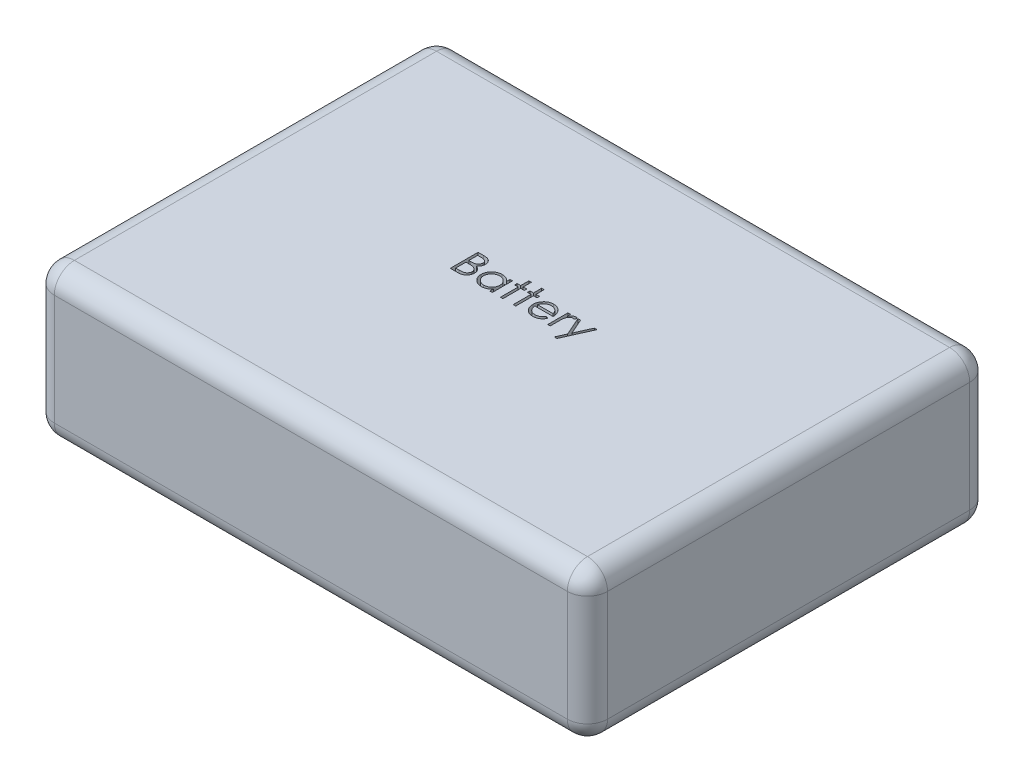
from build123d import *

# Parameters (mm, degrees)
SKETCH1_W           = 69.85
SKETCH1_H           = 50.8
BOSS_EXTRUDE1_DEPTH = 19.05
CUT_EXTRUDE1_DEPTH  = 2.54
FILLET1_R           = 2.54


with BuildPart() as part:
    # Sketch1 → Boss-Extrude1 (new body)
    with BuildSketch(Plane(origin=(0, 0, 0), x_dir=(1, 0, 0), z_dir=(0, 1, 0))):
        Rectangle(SKETCH1_W, SKETCH1_H)
    extrude(amount=BOSS_EXTRUDE1_DEPTH)

    # Sketch2 → Cut-Extrude1 (cut)
    # profile 1 of 7: a face of its own
    with BuildSketch(Plane(origin=(0, 19.05, 0), x_dir=(1, 0, 0), z_dir=(0, 1, 0))):
        with BuildLine():
            Line((-7.78525641, 3.5), (-7.102363782, 3.5))
            add(Edge.make_bspline(
                [(-7.102363782, 3.5), (-7.068935304, 3.49982425), (-7.004142594, 3.499483602), (-6.909923152, 3.49420047), (-6.821674341, 3.486996801), (-6.739370569, 3.475566708), (-6.663049866, 3.461774931), (-6.592482229, 3.445073115), (-6.527892057, 3.425046501), (-6.45077932, 3.39320022), (-6.36285866, 3.345877051), (-6.267660267, 3.275948486), (-6.186256027, 3.190416023), (-6.11606971, 3.093933368), (-6.060268591, 2.987797596), (-6.019899293, 2.874538407), (-5.994341418, 2.755616665), (-5.991712984, 2.673973487), (-5.990384615, 2.63271234)],
                knots=[0, 0, 0, 0, 1.001505555, 1.941167018, 2.826882275, 3.653841531, 4.429895133, 5.150066043, 5.825578002, 6.45369114, 7.647487171, 8.808567382, 9.977351308, 11.170798116, 12.373658725, 13.556498008, 14.765093433, 16, 16, 16, 16], degree=3))
            add(Edge.make_bspline(
                [(-5.990384615, 2.63271234), (-5.991477834, 2.594059784), (-5.993626111, 2.518103867), (-6.01416887, 2.407009758), (-6.046329539, 2.301258539), (-6.091034788, 2.201236154), (-6.149136784, 2.10920254), (-6.217995103, 2.024415274), (-6.301071905, 1.950464217), (-6.363315145, 1.909121315), (-6.394931891, 1.888120994)],
                knots=[0, 0, 0, 0, 1.044552857, 2.05264487, 3.044412934, 4.028983338, 5.005914585, 5.980388656, 6.974128949, 8, 8, 8, 8], degree=3))
            add(Edge.make_bspline(
                [(-6.394931891, 1.888120994), (-6.355171463, 1.872855995), (-6.279099916, 1.84365027), (-6.174413904, 1.792014806), (-6.084219059, 1.735852696), (-6.007821913, 1.674520846), (-5.942484258, 1.608412035), (-5.885431316, 1.536556921), (-5.836749942, 1.458018163), (-5.795037018, 1.373614627), (-5.762488262, 1.284208159), (-5.738112358, 1.190637383), (-5.724144909, 1.093237828), (-5.722157268, 1.026952448), (-5.721153846, 0.993489583)],
                knots=[0, 0, 0, 0, 1.27268992, 2.434971085, 3.483601985, 4.442670788, 5.356604649, 6.2567628, 7.179492994, 8.113709626, 9.066344395, 10.018646069, 10.999752585, 12, 12, 12, 12], degree=3))
            add(Edge.make_bspline(
                [(-5.721153846, 0.993489583), (-5.722130692, 0.959322711), (-5.724052664, 0.892098433), (-5.738232636, 0.793343299), (-5.762241743, 0.698968352), (-5.795312889, 0.608363169), (-5.838475204, 0.521703035), (-5.891003168, 0.438889771), (-5.953634732, 0.36075544), (-6.023697601, 0.286431817), (-6.102959746, 0.21960403), (-6.188475501, 0.160088323), (-6.281321821, 0.111142261), (-6.379973815, 0.070026239), (-6.485538131, 0.038619041), (-6.597540739, 0.016646467), (-6.71588504, 0.00184143), (-6.797094791, 0.000624225), (-6.838741987, 0)],
                knots=[0, 0, 0, 0, 0.978564426, 1.925352924, 2.850884081, 3.763762016, 4.682927383, 5.618979971, 6.567305752, 7.547517671, 8.540179244, 9.531824382, 10.526200242, 11.540722885, 12.589160233, 13.674978461, 14.80764778, 16, 16, 16, 16], degree=3))
            Line((-6.838741987, 0), (-7.78525641, 0))
            Line((-7.78525641, 0), (-7.78525641, 3.5))
        make_face()
        with BuildLine():
            Line((-7.471153846, 3.141025641), (-7.471153846, 2.019230769))
            Line((-7.471153846, 2.019230769), (-7.260116186, 2.019230769))
            add(Edge.make_bspline(
                [(-7.260116186, 2.019230769), (-7.229267391, 2.019630692), (-7.169661231, 2.020403425), (-7.083341335, 2.022616942), (-7.003216317, 2.028814985), (-6.929424483, 2.035011248), (-6.862082039, 2.045085835), (-6.801338178, 2.057077958), (-6.746239581, 2.069760863), (-6.682700036, 2.09133035), (-6.610627087, 2.123208025), (-6.533793983, 2.172679861), (-6.466059513, 2.231604215), (-6.408862326, 2.299595176), (-6.362050855, 2.374461362), (-6.32953714, 2.455008243), (-6.307489856, 2.539228375), (-6.305498324, 2.597046627), (-6.304487179, 2.626402244)],
                knots=[0, 0, 0, 0, 1.156816544, 2.235205308, 3.236616184, 4.169592532, 5.011045266, 5.787822928, 6.49130361, 7.128639758, 8.301311294, 9.436451833, 10.541879658, 11.654887649, 12.756523258, 13.837046038, 14.901820046, 16, 16, 16, 16], degree=3))
            add(Edge.make_bspline(
                [(-6.304487179, 2.626402244), (-6.30501336, 2.645828015), (-6.30604552, 2.683933787), (-6.314498822, 2.739483141), (-6.328866397, 2.791726894), (-6.34732069, 2.841381004), (-6.373109379, 2.886892854), (-6.403472842, 2.92983605), (-6.440158532, 2.968748169), (-6.481915845, 3.005117667), (-6.529924468, 3.037362195), (-6.584155759, 3.065602958), (-6.645343437, 3.088343735), (-6.712456292, 3.108259887), (-6.786527379, 3.122248181), (-6.866701932, 3.133901569), (-6.953636651, 3.139834311), (-7.013781754, 3.140619673), (-7.044871795, 3.141025641)],
                knots=[0, 0, 0, 0, 0.91205012, 1.789085906, 2.630437955, 3.453916878, 4.269457761, 5.079663411, 5.91843418, 6.774407191, 7.675494373, 8.627863946, 9.638891023, 10.736472738, 11.911756761, 13.175263542, 14.539845004, 16, 16, 16, 16], degree=3))
            Line((-7.044871795, 3.141025641), (-7.471153846, 3.141025641))
        make_face(mode=Mode.SUBTRACT)
        with BuildLine():
            Line((-7.471153846, 1.66025641), (-7.471153846, 0.358974359))
            Line((-7.471153846, 0.358974359), (-7.023838141, 0.358974359))
            add(Edge.make_bspline(
                [(-7.023838141, 0.358974359), (-6.991819215, 0.359358106), (-6.930106957, 0.360097729), (-6.841005726, 0.362512283), (-6.758422623, 0.368004559), (-6.682734487, 0.376650409), (-6.613124034, 0.386028858), (-6.550426331, 0.398640139), (-6.494133138, 0.413089099), (-6.42885883, 0.435423272), (-6.355355322, 0.470119743), (-6.276144465, 0.522433969), (-6.205718247, 0.584757277), (-6.145912988, 0.656888191), (-6.096899999, 0.735319518), (-6.061244544, 0.818464868), (-6.039253688, 0.904950395), (-6.036591518, 0.963917108), (-6.03525641, 0.993489583)],
                knots=[0, 0, 0, 0, 1.160039823, 2.235823828, 3.228722157, 4.157150951, 4.99529583, 5.772374946, 6.472645482, 7.099169577, 8.269452708, 9.405989375, 10.527446681, 11.663510218, 12.788923519, 13.866172445, 14.929861265, 16, 16, 16, 16], degree=3))
            add(Edge.make_bspline(
                [(-6.03525641, 0.993489583), (-6.035532515, 1.011982924), (-6.03608027, 1.048671306), (-6.044340885, 1.102587125), (-6.056354754, 1.154812998), (-6.071886188, 1.205490739), (-6.094505655, 1.253704115), (-6.1209122, 1.300406674), (-6.151873602, 1.345660154), (-6.200117768, 1.402872407), (-6.270289752, 1.46878942), (-6.369996528, 1.533326923), (-6.483368826, 1.58537473), (-6.565596319, 1.607474206), (-6.608072917, 1.618890224)],
                knots=[0, 0, 0, 0, 0.723448775, 1.435228256, 2.130040452, 2.821711965, 3.505591119, 4.210454504, 4.921174351, 5.648778258, 7.137944449, 8.670945889, 10.280296675, 12, 12, 12, 12], degree=3))
            add(Edge.make_bspline(
                [(-6.608072917, 1.618890224), (-6.625102013, 1.622345308), (-6.662024605, 1.629836643), (-6.722232185, 1.637744346), (-6.790968054, 1.644789406), (-6.868390931, 1.650000564), (-6.954598773, 1.655387107), (-7.049775691, 1.657481929), (-7.153533006, 1.659981189), (-7.225525378, 1.660162323), (-7.262920673, 1.66025641)],
                knots=[0, 0, 0, 0, 0.634451884, 1.375622551, 2.216452059, 3.157844607, 4.20941857, 5.370758133, 6.634282058, 8, 8, 8, 8], degree=3))
            Line((-7.262920673, 1.66025641), (-7.471153846, 1.66025641))
        make_face(mode=Mode.SUBTRACT)
    # profile 2 of 7: a face of its own
    with BuildSketch(Plane(origin=(0, 19.05, 0), x_dir=(1, 0, 0), z_dir=(0, 1, 0))):
        with BuildLine():
            Line((-2.490384615, 2.557692308), (-2.490384615, 0))
            Line((-2.490384615, 0), (-2.804487179, 0))
            Line((-2.804487179, 0), (-2.804487179, 0.442407853))
            add(Edge.make_bspline(
                [(-2.804487179, 0.442407853), (-2.83990597, 0.402368259), (-2.909026185, 0.324230488), (-3.024467303, 0.222148315), (-3.146835481, 0.137769993), (-3.275536802, 0.069620078), (-3.410455046, 0.018428021), (-3.551291133, -0.017958138), (-3.698102514, -0.041351973), (-3.798354869, -0.043687995), (-3.849158654, -0.044871795)],
                knots=[0, 0, 0, 0, 1.074387032, 2.096679803, 3.090159297, 4.057316773, 5.018401886, 5.985159533, 6.978961417, 8, 8, 8, 8], degree=3))
            add(Edge.make_bspline(
                [(-3.849158654, -0.044871795), (-3.894326608, -0.043645423), (-3.983399813, -0.041226962), (-4.11442889, -0.022464659), (-4.240521139, 0.007665963), (-4.361795712, 0.049566853), (-4.477467857, 0.105147674), (-4.588527954, 0.171688922), (-4.694400646, 0.250929752), (-4.793472185, 0.341517781), (-4.884704185, 0.439912768), (-4.964765458, 0.544858315), (-5.031518538, 0.655900619), (-5.087338618, 0.771633773), (-5.130334963, 0.892948692), (-5.160308597, 1.01942586), (-5.179049044, 1.150915734), (-5.181466505, 1.240455257), (-5.182692308, 1.285857372)],
                knots=[0, 0, 0, 0, 1.033919861, 2.038935746, 3.024066025, 3.998881131, 4.97069526, 5.957263378, 6.95902576, 7.993208707, 9.027059324, 10.027763471, 11.009749337, 11.988697705, 12.965288445, 13.950418724, 14.960734635, 16, 16, 16, 16], degree=3))
            add(Edge.make_bspline(
                [(-5.182692308, 1.285857372), (-5.181439336, 1.330321075), (-5.178962279, 1.418223419), (-5.16050906, 1.547502117), (-5.129478051, 1.672020377), (-5.085930203, 1.791377321), (-5.030088248, 1.905717371), (-4.962160161, 2.015121396), (-4.882141037, 2.119890793), (-4.78988863, 2.21756202), (-4.689953859, 2.307782634), (-4.583045129, 2.38619168), (-4.471821847, 2.453908529), (-4.354558837, 2.507562005), (-4.232991732, 2.550971109), (-4.106038286, 2.581004078), (-3.974226707, 2.598701399), (-3.884736215, 2.601264163), (-3.839342949, 2.602564103)],
                knots=[0, 0, 0, 0, 1.020392517, 2.01726096, 2.990465484, 3.961182959, 4.928053699, 5.906110375, 6.912531644, 7.948652711, 8.985773172, 9.998621852, 10.987621588, 11.969261332, 12.953316658, 13.946091881, 14.958173133, 16, 16, 16, 16], degree=3))
            add(Edge.make_bspline(
                [(-3.839342949, 2.602564103), (-3.78714309, 2.601126351), (-3.68478163, 2.598306988), (-3.53505362, 2.574844261), (-3.393409143, 2.535205794), (-3.25875479, 2.481288296), (-3.131574104, 2.409639567), (-3.01307112, 2.319259606), (-2.902005637, 2.210718419), (-2.837625345, 2.127347974), (-2.804487179, 2.084435096)],
                knots=[0, 0, 0, 0, 1.038897134, 2.037228247, 3.008116434, 3.962042015, 4.918381754, 5.904844433, 6.921570401, 8, 8, 8, 8], degree=3))
            Line((-2.804487179, 2.084435096), (-2.804487179, 2.557692308))
            Line((-2.804487179, 2.557692308), (-2.490384615, 2.557692308))
        make_face()
        with BuildLine():
            add(Edge.make_bspline(
                [(-3.835136218, 2.288461538), (-3.881050556, 2.286827901), (-3.971678156, 2.28360336), (-4.104722158, 2.258429865), (-4.232035572, 2.21654527), (-4.352981646, 2.159263369), (-4.465649863, 2.087234632), (-4.566343534, 2.000113249), (-4.655886235, 1.900276235), (-4.731194499, 1.788174125), (-4.792584996, 1.667996033), (-4.835752028, 1.542371595), (-4.864221276, 1.413566618), (-4.867129796, 1.326203932), (-4.868589744, 1.282351763)],
                knots=[0, 0, 0, 0, 1.031046209, 2.035121221, 3.029706178, 4.034933723, 5.034054252, 6.02443088, 7.017295772, 8.038157696, 9.050218397, 10.03989886, 11.016116709, 12, 12, 12, 12], degree=3))
            add(Edge.make_bspline(
                [(-4.868589744, 1.282351763), (-4.86672485, 1.238761656), (-4.863002373, 1.1517523), (-4.836251679, 1.022771723), (-4.791371806, 0.897117681), (-4.730129743, 0.775856687), (-4.653443118, 0.663272587), (-4.564554466, 0.561532464), (-4.462604184, 0.474042876), (-4.349676677, 0.400805303), (-4.229068707, 0.341642782), (-4.102234775, 0.300477142), (-3.971559137, 0.273899362), (-3.882706803, 0.270794885), (-3.837940705, 0.269230769)],
                knots=[0, 0, 0, 0, 0.979072187, 1.954306742, 2.945804271, 3.96968567, 4.997920485, 5.998718438, 6.996577872, 8.005894225, 9.015743152, 10.005417472, 10.995077863, 12, 12, 12, 12], degree=3))
            add(Edge.make_bspline(
                [(-3.837940705, 0.269230769), (-3.792494202, 0.270890733), (-3.702105616, 0.274192237), (-3.568666908, 0.299473502), (-3.439171945, 0.3412423), (-3.315384717, 0.399141427), (-3.200068586, 0.470898783), (-3.096570708, 0.554905874), (-3.00905474, 0.652609058), (-2.93486213, 0.759985511), (-2.876686713, 0.877697508), (-2.834310654, 1.003031698), (-2.809256748, 1.135992447), (-2.806099019, 1.226856374), (-2.804487179, 1.273237179)],
                knots=[0, 0, 0, 0, 1.01762866, 2.023962475, 3.030623092, 4.058876274, 5.077231937, 6.066672613, 7.034107872, 8.005628644, 8.981990164, 9.965428785, 10.961468474, 12, 12, 12, 12], degree=3))
            add(Edge.make_bspline(
                [(-2.804487179, 1.273237179), (-2.805446836, 1.30857501), (-2.807335743, 1.378131043), (-2.821766313, 1.480258561), (-2.844721239, 1.577992287), (-2.877067409, 1.671434976), (-2.919558694, 1.760069991), (-2.97080646, 1.844533752), (-3.031711909, 1.924386963), (-3.101294605, 1.998530034), (-3.177459808, 2.066156496), (-3.258054349, 2.126520737), (-3.344033096, 2.17610951), (-3.433950132, 2.217150781), (-3.527961467, 2.249809931), (-3.626832087, 2.271597625), (-3.729511074, 2.286557946), (-3.799557129, 2.287820327), (-3.835136218, 2.288461538)],
                knots=[0, 0, 0, 0, 1.050140795, 2.067009409, 3.05949893, 4.030605086, 5.00011959, 5.97591094, 6.962425594, 7.979863591, 8.993523472, 9.986985069, 10.967611495, 11.937549037, 12.921786183, 13.919465291, 14.943216303, 16, 16, 16, 16], degree=3))
        make_face(mode=Mode.SUBTRACT)
    # profile 3 of 7: a face of its own
    with BuildSketch(Plane(origin=(0, 19.05, 0), x_dir=(1, 0, 0), z_dir=(0, 1, 0))):
        Polygon((-1.458333333, 3.58974359), (-1.144230769, 3.58974359), (-1.144230769, 2.557692308), (-0.695512821, 2.557692308), (-0.695512821, 2.243589744), (-1.144230769, 2.243589744), (-1.144230769, 0), (-1.458333333, 0), (-1.458333333, 2.243589744), (-1.907051282, 2.243589744), (-1.907051282, 2.557692308), (-1.458333333, 2.557692308), align=None)
    # profile 4 of 7: a face of its own
    with BuildSketch(Plane(origin=(0, 19.05, 0), x_dir=(1, 0, 0), z_dir=(0, 1, 0))):
        Polygon((0.157051282, 3.58974359), (0.471153846, 3.58974359), (0.471153846, 2.557692308), (0.919871795, 2.557692308), (0.919871795, 2.243589744), (0.471153846, 2.243589744), (0.471153846, 0), (0.157051282, 0), (0.157051282, 2.243589744), (-0.291666667, 2.243589744), (-0.291666667, 2.557692308), (0.157051282, 2.557692308), align=None)
    # profile 5 of 7: a face of its own
    with BuildSketch(Plane(origin=(0, 19.05, 0), x_dir=(1, 0, 0), z_dir=(0, 1, 0))):
        with BuildLine():
            Line((3.557491987, 0.807692308), (3.836538462, 0.661157853))
            add(Edge.make_bspline(
                [(3.836538462, 0.661157853), (3.814301866, 0.621714521), (3.771038258, 0.544973418), (3.69663751, 0.439541558), (3.618645437, 0.344693842), (3.533541469, 0.262964188), (3.44387179, 0.191712803), (3.349139136, 0.129374978), (3.248850318, 0.076256458), (3.143000593, 0.03150393), (3.030701042, -0.002905564), (2.911679526, -0.027209785), (2.78570803, -0.042233054), (2.69936185, -0.043978194), (2.655148237, -0.044871795)],
                knots=[0, 0, 0, 0, 1.120438281, 2.179929193, 3.190490725, 4.156257408, 5.095198341, 6.022838206, 6.959905092, 7.901321166, 8.864066838, 9.862729781, 10.905609505, 12, 12, 12, 12], degree=3))
            add(Edge.make_bspline(
                [(2.655148237, -0.044871795), (2.60600626, -0.04372462), (2.510144498, -0.041486813), (2.370604751, -0.022194348), (2.239225332, 0.00927801), (2.116013629, 0.053243552), (2.001271377, 0.110670876), (1.894770522, 0.180630358), (1.795950996, 0.262762612), (1.707926787, 0.357779056), (1.628682904, 0.459461013), (1.558757084, 0.565416898), (1.500299653, 0.675380122), (1.452747043, 0.788650646), (1.414342178, 0.90451454), (1.387575474, 1.024026007), (1.372145726, 1.146861592), (1.36978128, 1.229958927), (1.368589744, 1.271834936)],
                knots=[0, 0, 0, 0, 1.145258523, 2.234067595, 3.276747158, 4.290159414, 5.277019952, 6.260822364, 7.254936242, 8.264827045, 9.274100331, 10.257902744, 11.220704747, 12.172965371, 13.118907548, 14.062713208, 15.023725156, 16, 16, 16, 16], degree=3))
            add(Edge.make_bspline(
                [(1.368589744, 1.271834936), (1.369648885, 1.311129766), (1.371747963, 1.389006931), (1.384978751, 1.504272476), (1.408427044, 1.616300928), (1.440603368, 1.725185376), (1.482154614, 1.83074351), (1.532986833, 1.933039574), (1.593179211, 2.031964713), (1.639651885, 2.094367847), (1.663060897, 2.125801282)],
                knots=[0, 0, 0, 0, 1.024358464, 2.0301432, 3.019427413, 4.004406732, 4.986367066, 5.972626655, 6.978780325, 8, 8, 8, 8], degree=3))
            add(Edge.make_bspline(
                [(1.663060897, 2.125801282), (1.69476858, 2.163670152), (1.757179527, 2.238208303), (1.862735882, 2.336146628), (1.977036079, 2.418190404), (2.098647705, 2.48619754), (2.228984179, 2.537871187), (2.36629347, 2.576378769), (2.512139056, 2.59795678), (2.611844277, 2.601004614), (2.662860577, 2.602564103)],
                knots=[0, 0, 0, 0, 1.030682036, 2.02871468, 2.997146059, 3.962720338, 4.930598197, 5.918074684, 6.934738563, 8, 8, 8, 8], degree=3))
            add(Edge.make_bspline(
                [(2.662860577, 2.602564103), (2.715308182, 2.601210054), (2.818198428, 2.598553718), (2.968230549, 2.573927385), (3.110191266, 2.53487483), (3.24402377, 2.47972104), (3.369741631, 2.408561488), (3.48652768, 2.320419647), (3.596379193, 2.218001559), (3.660287772, 2.13923835), (3.692808494, 2.099158654)],
                knots=[0, 0, 0, 0, 1.056321875, 2.072262726, 3.055038591, 4.01806755, 4.982017516, 5.957941055, 6.960871419, 8, 8, 8, 8], degree=3))
            add(Edge.make_bspline(
                [(3.692808494, 2.099158654), (3.714935432, 2.068955072), (3.759042025, 2.008748954), (3.814289125, 1.910577797), (3.86224652, 1.807867202), (3.900579481, 1.698956905), (3.931618982, 1.585137325), (3.954075801, 1.46559478), (3.96724542, 1.340364869), (3.969834117, 1.255038314), (3.971153846, 1.211538462)],
                knots=[0, 0, 0, 0, 0.94817472, 1.890038105, 2.849395472, 3.817997239, 4.812318967, 5.836947057, 6.897266129, 8, 8, 8, 8], degree=3))
            Line((3.971153846, 1.211538462), (1.682692308, 1.211538462))
            add(Edge.make_bspline(
                [(1.682692308, 1.211538462), (1.684231914, 1.177837997), (1.687259488, 1.111567394), (1.701374631, 1.01459661), (1.723623405, 0.922223268), (1.754892468, 0.835140226), (1.792759313, 0.752210099), (1.83914503, 0.674048062), (1.894484584, 0.601010132), (1.956210283, 0.532442994), (2.024917378, 0.471382233), (2.097200126, 0.416730457), (2.174093691, 0.37092486), (2.254991774, 0.33374497), (2.339763559, 0.304638654), (2.428435754, 0.284770834), (2.520833871, 0.271463727), (2.583819605, 0.269984061), (2.615885417, 0.269230769)],
                knots=[0, 0, 0, 0, 1.094153842, 2.151609401, 3.174256925, 4.172055639, 5.149267565, 6.128595816, 7.11444997, 8.118368179, 9.117203808, 10.09244225, 11.054858984, 12.015122123, 12.976791628, 13.957293641, 14.960065497, 16, 16, 16, 16], degree=3))
            add(Edge.make_bspline(
                [(2.615885417, 0.269230769), (2.647236564, 0.269838826), (2.709443255, 0.271045327), (2.802084113, 0.282777238), (2.89322364, 0.301747513), (2.982484623, 0.327637504), (3.068055469, 0.359214356), (3.147301019, 0.397317213), (3.220181235, 0.43946696), (3.288298201, 0.487676635), (3.354369195, 0.546684822), (3.419911681, 0.620320543), (3.490188335, 0.707408071), (3.534177927, 0.772953737), (3.557491987, 0.807692308)],
                knots=[0, 0, 0, 0, 0.99110716, 1.966546729, 2.947904876, 3.932708344, 4.903319531, 5.828989031, 6.710028674, 7.56322171, 8.463672341, 9.504779593, 10.677557249, 12, 12, 12, 12], degree=3))
        make_face()
        with BuildLine():
            add(Edge.make_bspline(
                [(3.657051282, 1.525641026), (3.645554657, 1.567303899), (3.623427356, 1.64749152), (3.577190992, 1.75853241), (3.525119451, 1.857220311), (3.463497719, 1.942799944), (3.393678994, 2.018803457), (3.313033811, 2.085222043), (3.222597918, 2.144639494), (3.122838777, 2.194791993), (3.017196992, 2.237481852), (2.9065908, 2.266106968), (2.793733012, 2.28571651), (2.717398726, 2.287542618), (2.678986378, 2.288461538)],
                knots=[0, 0, 0, 0, 1.154881502, 2.222775134, 3.210006277, 4.132804581, 5.035138423, 5.962687519, 6.919655026, 7.923214229, 8.944639381, 9.960483929, 10.97369054, 12, 12, 12, 12], degree=3))
            add(Edge.make_bspline(
                [(2.678986378, 2.288461538), (2.64763694, 2.287849867), (2.585665691, 2.286640721), (2.494364622, 2.275170592), (2.406684924, 2.256210747), (2.321979636, 2.23024579), (2.241358768, 2.195637188), (2.163163999, 2.155053961), (2.089383603, 2.105512377), (2.043242308, 2.067753522), (2.019931891, 2.048677885)],
                knots=[0, 0, 0, 0, 1.04873581, 2.073130211, 3.073294108, 4.04793562, 5.032784715, 6.005352987, 6.992311501, 8, 8, 8, 8], degree=3))
            add(Edge.make_bspline(
                [(2.019931891, 2.048677885), (2.003238609, 2.033583569), (1.969455475, 2.003036353), (1.924314953, 1.950407146), (1.881094481, 1.893655584), (1.841760828, 1.83061046), (1.805683241, 1.761989681), (1.771923264, 1.688372045), (1.741536852, 1.609198915), (1.724440742, 1.554026476), (1.715645032, 1.525641026)],
                knots=[0, 0, 0, 0, 0.879870761, 1.780643979, 2.707998968, 3.669668524, 4.684282772, 5.740141944, 6.837334558, 8, 8, 8, 8], degree=3))
            Line((1.715645032, 1.525641026), (3.657051282, 1.525641026))
        make_face(mode=Mode.SUBTRACT)
    # profile 6 of 7: a face of its own
    with BuildSketch(Plane(origin=(0, 19.05, 0), x_dir=(1, 0, 0), z_dir=(0, 1, 0))):
        with BuildLine():
            Line((4.509615385, 2.557692308), (4.823717949, 2.557692308))
            Line((4.823717949, 2.557692308), (4.823717949, 2.181189904))
            add(Edge.make_bspline(
                [(4.823717949, 2.181189904), (4.846906707, 2.216245732), (4.891255028, 2.283289731), (4.964967958, 2.371959032), (5.040471289, 2.445374079), (5.118126476, 2.503877598), (5.198504576, 2.547690717), (5.279841528, 2.579783752), (5.363416998, 2.598761067), (5.419578922, 2.601294726), (5.447716346, 2.602564103)],
                knots=[0, 0, 0, 0, 1.2804753, 2.448899062, 3.506932113, 4.484331642, 5.4025378, 6.288909075, 7.142734305, 8, 8, 8, 8], degree=3))
            add(Edge.make_bspline(
                [(5.447716346, 2.602564103), (5.469542673, 2.601373576), (5.514451758, 2.59892399), (5.582434348, 2.581713165), (5.6524778, 2.554235143), (5.697620187, 2.52839492), (5.721153846, 2.514923878)],
                knots=[0, 0, 0, 0, 0.901110191, 1.854092781, 2.881294221, 4, 4, 4, 4], degree=3))
            Line((5.721153846, 2.514923878), (5.548677885, 2.242888622))
            add(Edge.make_bspline(
                [(5.548677885, 2.242888622), (5.533568863, 2.249628888), (5.504889049, 2.262423203), (5.462934483, 2.277565213), (5.424253146, 2.286481129), (5.399609588, 2.287831847), (5.388120994, 2.288461538)],
                knots=[0, 0, 0, 0, 1.180555205, 2.24091978, 3.179933427, 4, 4, 4, 4], degree=3))
            add(Edge.make_bspline(
                [(5.388120994, 2.288461538), (5.36291526, 2.286781501), (5.31150287, 2.283354712), (5.236018371, 2.256415904), (5.162771165, 2.212890664), (5.104599503, 2.164619552), (5.05955725, 2.118071755), (5.027417024, 2.077423352), (4.997934278, 2.031844721), (4.969764057, 1.982115037), (4.944097763, 1.927385191), (4.920143094, 1.868201977), (4.898484231, 1.804496849), (4.886133987, 1.760114328), (4.879807692, 1.737379808)],
                knots=[0, 0, 0, 0, 1.125678352, 2.296057538, 3.5422874, 4.923748041, 5.663163013, 6.437101912, 7.23742474, 8.08941207, 8.991984279, 9.93940061, 10.944477711, 12, 12, 12, 12], degree=3))
            add(Edge.make_bspline(
                [(4.879807692, 1.737379808), (4.875075299, 1.717102634), (4.864593407, 1.672190235), (4.854401869, 1.596841711), (4.844332351, 1.507818052), (4.837235733, 1.404871459), (4.830657691, 1.288259015), (4.826947609, 1.15780307), (4.823844468, 1.013369718), (4.823761401, 0.912395365), (4.823717949, 0.859575321)],
                knots=[0, 0, 0, 0, 0.566838948, 1.255505196, 2.06880316, 3.007127437, 4.065329342, 5.249902469, 6.561414163, 8, 8, 8, 8], degree=3))
            Line((4.823717949, 0.859575321), (4.823717949, 0))
            Line((4.823717949, 0), (4.509615385, 0))
            Line((4.509615385, 0), (4.509615385, 2.557692308))
        make_face()
    # profile 7 of 7: a face of its own
    with BuildSketch(Plane(origin=(0, 19.05, 0), x_dir=(1, 0, 0), z_dir=(0, 1, 0))):
        Polygon((5.766025641, 2.557692308), (6.104667468, 2.557692308), (6.970552885, 0.598758013), (7.849759615, 2.557692308), (8.189102564, 2.557692308), (6.618589744, -0.942307692), (6.279246795, -0.942307692), (6.800180288, 0.218048878), align=None)
    extrude(amount=-CUT_EXTRUDE1_DEPTH, mode=Mode.SUBTRACT)

    # Fillet1
    fillet1_edges = [part.edges().sort_by_distance(p)[0] for p in [
        (-34.925, 19.05, 0),
        (0, 19.05, 25.4),
        (34.925, 19.05, 0),
        (0, 0, 25.4),
        (-34.925, 0, 0),
        (0, 0, -25.4),
        (34.925, 0, 0),
        (0, 19.05, -25.4),
        (34.925, 9.525, 25.4),
        (-34.925, 9.525, 25.4),
        (-34.925, 9.525, -25.4),
        (34.925, 9.525, -25.4),
    ]]
    fillet(fillet1_edges, radius=FILLET1_R)


solid = part.part
